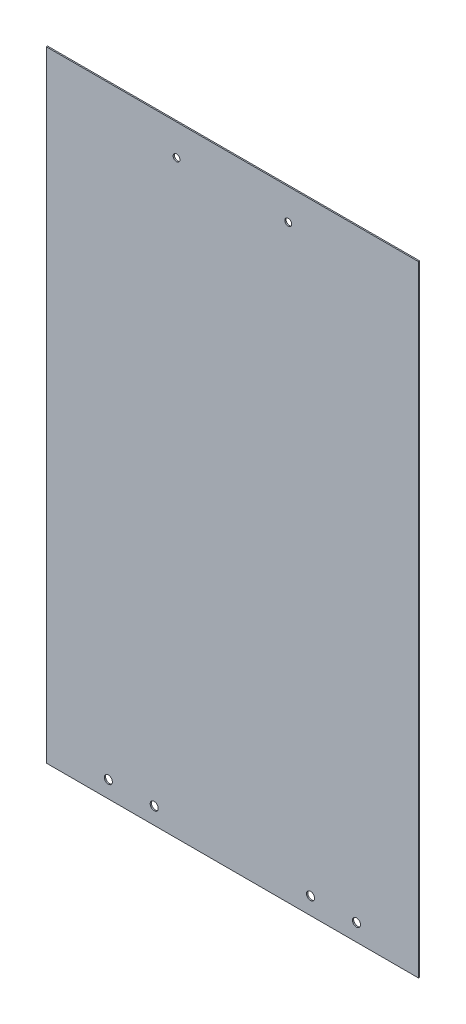
from build123d import *

# Parameters (mm, degrees)
SKETCH1_W                      = 300
SKETCH1_H                      = 500
BOSS_EXTRUDE1_DEPTH            = 1
SKETCH2_R                      = 3.25
CUT_EXTRUDE1_DEPTH             = 801.391154374
SKETCH3_R                      = 2.75
M5_CLEARANCE_5_5_MM_THRU_DEPTH = 801.391154374
F_6_5_6_5_DIAMETER_SLOT2_D     = 6.5


with BuildPart() as part:
    # Sketch1 → Boss-Extrude1 (new body)
    with BuildSketch(Plane(origin=(0, 0, -0.1), x_dir=(-1, 0, 0), z_dir=(0, 0, -1))):
        with Locations((-475, 250)):
            Rectangle(SKETCH1_W, SKETCH1_H)
    extrude(amount=-BOSS_EXTRUDE1_DEPTH)

    # Sketch2 → Cut-Extrude1 (cut, through all)
    with BuildSketch(Plane(origin=(0, 0, -0.1), x_dir=(-1, 0, 0), z_dir=(0, 0, -1))):
        with Locations((-538, 13.75)):
            Circle(SKETCH2_R)
        with Locations((-575, 13.75)):
            Circle(SKETCH2_R)
    extrude(amount=-CUT_EXTRUDE1_DEPTH, mode=Mode.SUBTRACT)

    # Sketch3 → M5 clearance- 5.5 mm -thru (cut, through all)
    with BuildSketch(Plane(origin=(0, 0, -0.1), x_dir=(-1, 0, 0), z_dir=(0, 0, -1))):
        with Locations((-520, 475)):
            Circle(SKETCH3_R)
        with Locations((-430, 475)):
            Circle(SKETCH3_R)
    extrude(amount=-M5_CLEARANCE_5_5_MM_THRU_DEPTH, mode=Mode.SUBTRACT)

    # Ø6.5 (6.5) Diameter Slot2 (through all)
    with Locations(Plane(origin=(0, 0, -0.1), x_dir=(-1, 0, 0), z_dir=(0, 0, -1))):
        with Locations((-412, 13.5), (-375, 13.5)):
            Hole(F_6_5_6_5_DIAMETER_SLOT2_D / 2)


solid = part.part
